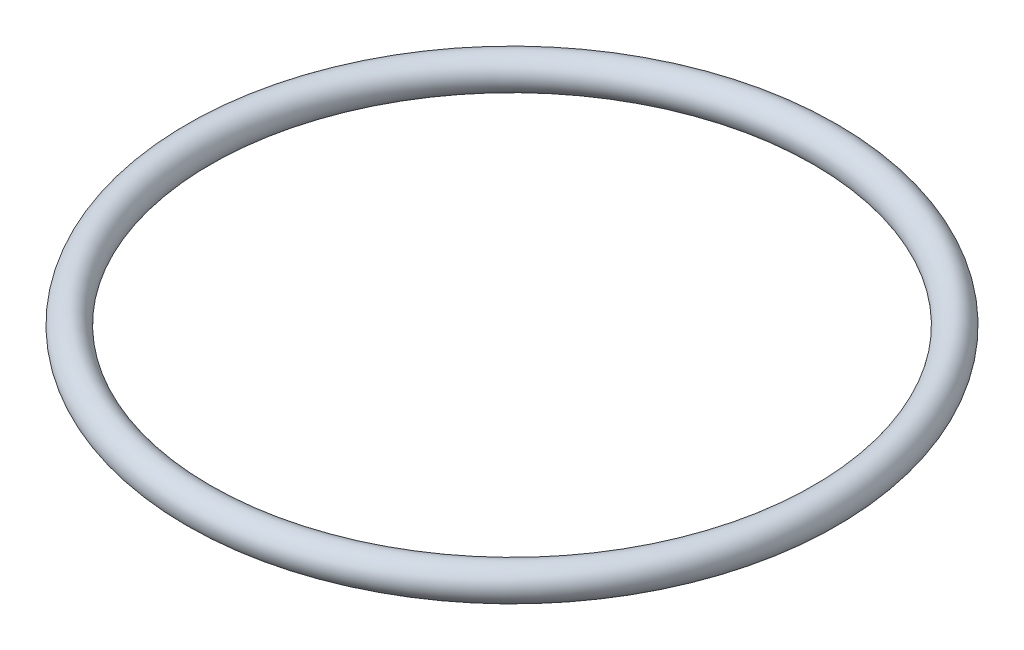
from build123d import *

# Parameters (mm, degrees)
SKETCH_2_R = 1.5


with BuildPart() as part:
    # 扫描1: sweep along a path in 草图1
    with BuildLine(Plane(origin=(0, 0, 0), x_dir=(1, 0, 0), z_dir=(0, 1, 0))) as sweep_1_path:
        CenterArc((0, 0), 28.5, 0, 360)
    # 草图2 → 扫描1 (sweep)
    with BuildSketch(Plane.XY):
        with Locations((-28.5, 0)):
            Circle(SKETCH_2_R)
    sweep(path=sweep_1_path.line)


solid = part.part
